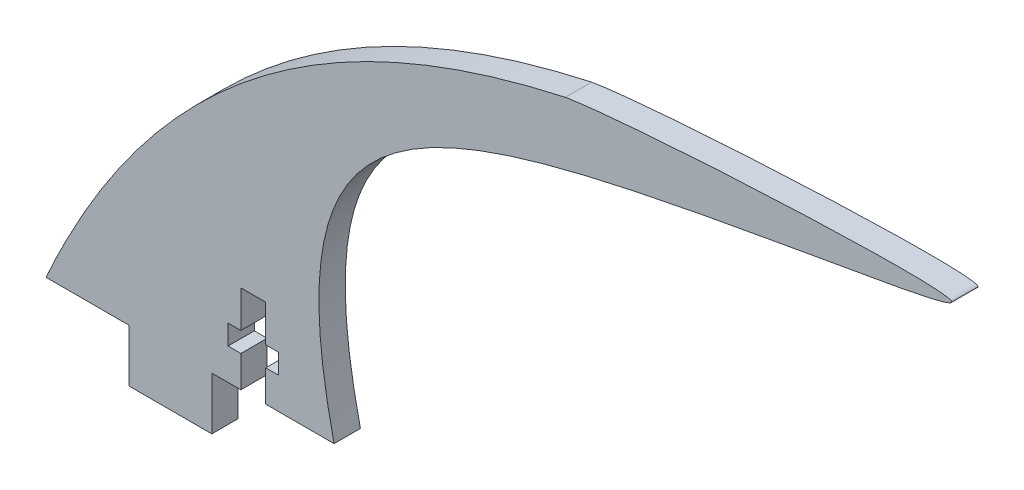
from build123d import *

# Parameters (mm, degrees)
BOSS_EXTRUDE1_DEPTH = 3.175
SKETCH3_W           = 10
SKETCH3_H           = 6.35
BOSS_EXTRUDE2_DEPTH = 3.175
CUT_EXTRUDE2_DEPTH  = 177.022079196


with BuildPart() as part:
    # Sketch2 → Boss-Extrude1 (new body)
    with BuildSketch(Plane.XY):
        with BuildLine():
            Line((-171.469047232, -33.299180798), (-136.722420558, -33.299180798))
            add(Edge.make_bspline(
                [(-108.83788229, 16.821692005), (-99.669845231, 18.306784822), (-32.549173603, 21.473066917), (-123.012581298, 9.730472521), (-143.484345896, -3.902144784), (-136.722420558, -33.299180798)],
                knots=[0, 0, 0, 0, 0.306498188, 0.587227704, 1, 1, 1, 1], degree=3))
            add(Edge.make_bspline(
                [(-108.83788229, 16.821692005), (-134.727370928, 11.133168188), (-157.456147897, -2.082080449), (-171.469047232, -33.299180798)],
                knots=[0.527310124, 0.527310124, 0.527310124, 0.527310124, 1, 1, 1, 1], degree=3))
        make_face()
    extrude(amount=BOSS_EXTRUDE1_DEPTH)

    # Sketch3 → Boss-Extrude2 (add)
    with BuildSketch(Plane.XY.offset(3.175)):
        with Locations((-156.469047232, -36.474180798)):
            Rectangle(SKETCH3_W, SKETCH3_H)
    extrude(amount=-BOSS_EXTRUDE2_DEPTH)

    # Sketch5 → Cut-Extrude2 (cut, through all)
    with BuildSketch(Plane.XY.offset(3.175)):
        Polygon((-147.969047232, -33.299180798), (-144.969047232, -33.299180798), (-144.969047232, -29.499180798), (-143.419047232, -29.499180798), (-143.419047232, -27.099180798), (-144.969047232, -27.099180798), (-144.969047232, -22.649180798), (-147.969047232, -22.649180798), (-147.969047232, -27.099180798), (-149.519047232, -27.099180798), (-149.519047232, -29.499180798), (-147.969047232, -29.499180798), align=None)
    extrude(amount=-CUT_EXTRUDE2_DEPTH, mode=Mode.SUBTRACT)


solid = part.part
